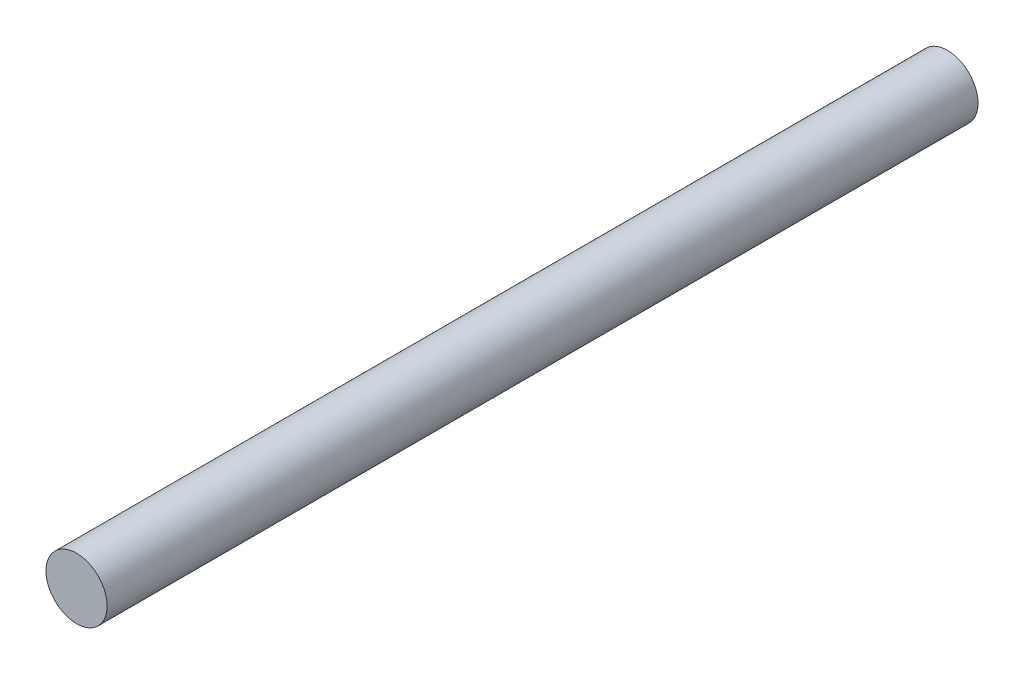
from build123d import *

# Parameters (mm, degrees)
SKETCH1_R           = 4
BOSS_EXTRUDE1_DEPTH = 114


with BuildPart() as part:
    # Sketch1 → Boss-Extrude1 (new body)
    with BuildSketch(Plane.XY):
        with Locations(Location((0, 0, 0), (0, 0, 180))):
            Circle(SKETCH1_R)
    extrude(amount=BOSS_EXTRUDE1_DEPTH)


solid = part.part
